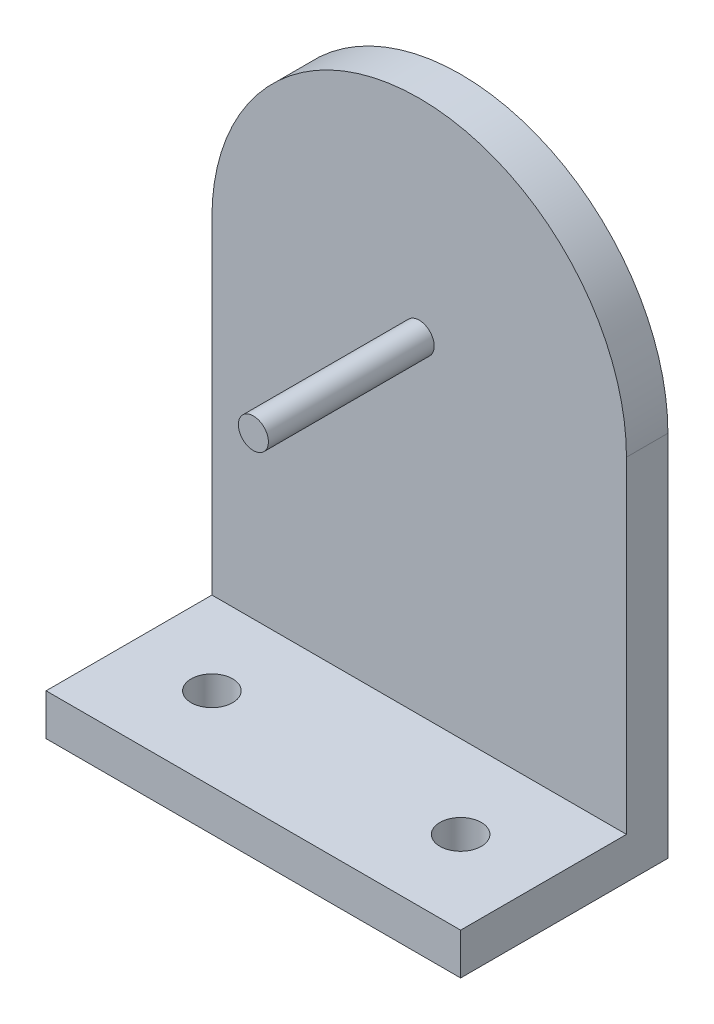
from build123d import *

# Parameters (mm, degrees)
BOSS_EXTRUDE1_DEPTH = 3.175
SKETCH4_W           = 31.75
SKETCH4_H           = 3.175
BOSS_EXTRUDE2_DEPTH = 12.7
SKETCH5_R           = 1.5875
CUT_EXTRUDE2_DEPTH  = 47.651371748
SKETCH6_R           = 1.15
BOSS_EXTRUDE3_DEPTH = 12.7


with BuildPart() as part:
    # Sketch1 → Boss-Extrude1 (new body)
    with BuildSketch(Plane.XY):
        with BuildLine():
            ThreePointArc((15.875, 0), (0, 15.875), (-15.875, 0))
            Line((-15.875, 0), (15.875, 0))
        make_face()
        with BuildLine():
            ThreePointArc((15.875, 0), (0, -15.875), (-15.875, 0))
            Line((-15.875, 0), (-15.875, -28.194))
            Line((-15.875, -28.194), (15.875, -28.194))
            Line((15.875, -28.194), (15.875, 0))
        make_face()
        with BuildLine():
            Line((15.875, 0), (-15.875, 0))
            ThreePointArc((-15.875, 0), (0, -15.875), (15.875, 0))
        make_face()
    extrude(amount=BOSS_EXTRUDE1_DEPTH)

    # Sketch4 → Boss-Extrude2 (add)
    with BuildSketch(Plane.XY.offset(3.175)):
        with Locations((0, -26.6065)):
            Rectangle(SKETCH4_W, SKETCH4_H)
    extrude(amount=BOSS_EXTRUDE2_DEPTH)

    # Sketch5 → Cut-Extrude2 (cut, through all)
    with BuildSketch(Plane(origin=(0, -25.019, 0), x_dir=(1, 0, 0), z_dir=(0, 1, 0))):
        with Locations(Location((-9.525, -9.525, 0), (0, 0, 270))):
            Circle(SKETCH5_R)
        with Locations(Location((9.525, -9.525, 0), (0, 0, 90))):
            Circle(SKETCH5_R)
    extrude(amount=-CUT_EXTRUDE2_DEPTH, mode=Mode.SUBTRACT)

    # Sketch6 → Boss-Extrude3 (add, through all)
    with BuildSketch(Plane.XY.offset(3.175)):
        Circle(SKETCH6_R)
    extrude(amount=BOSS_EXTRUDE3_DEPTH)


solid = part.part
